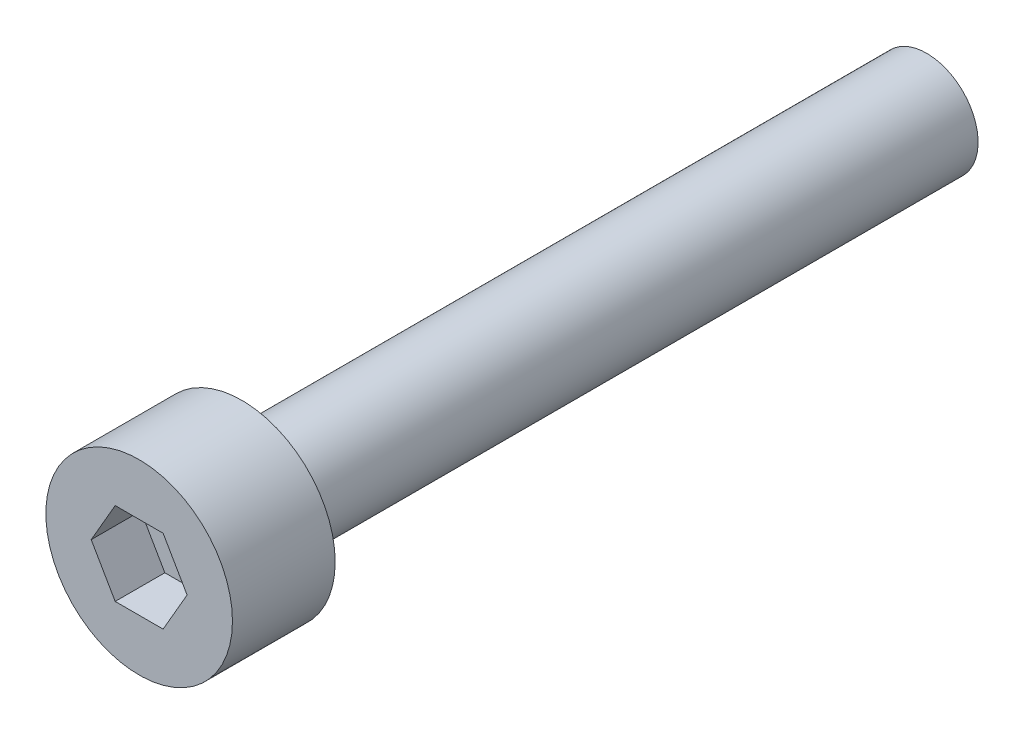
from build123d import *

# Parameters (mm, degrees)
SKETCH1_W           = 2.725
SKETCH1_H           = 3
SKETCH2_R           = 1.5
BOSS_EXTRUDE1_DEPTH = 3
SKETCH3_R           = 1.5
BOSS_EXTRUDE2_DEPTH = 17
CUT_EXTRUDE1_DEPTH  = 1.45


with BuildPart() as part:
    # Sketch1 → Revolve1 (revolve)
    with BuildSketch(Plane(origin=(0, 0, 0), x_dir=(1, 0, 0), z_dir=(0, 1, 0))):
        with Locations((1.3625, 1.5)):
            Rectangle(SKETCH1_W, SKETCH1_H)
    revolve(axis=Axis((0, 0, -3), (0, 0, 1)))

    # Sketch2 → Boss-Extrude1 (add)
    with BuildSketch(Plane(origin=(0, 0, -3), x_dir=(-1, 0, 0), z_dir=(0, 0, -1))):
        Circle(SKETCH2_R)
    extrude(amount=BOSS_EXTRUDE1_DEPTH)

    # Sketch3 → Boss-Extrude2 (add)
    with BuildSketch(Plane(origin=(0, 0, -6), x_dir=(-1, 0, 0), z_dir=(0, 0, -1))):
        Circle(SKETCH3_R)
    extrude(amount=BOSS_EXTRUDE2_DEPTH)

    # Sketch4 → Cut-Extrude1 (cut)
    with BuildSketch(Plane.XY):
        Polygon((-1.4, 0), (-0.7, -1.212435565), (0.7, -1.212435565), (1.4, 0), (0.7, 1.212435565), (-0.7, 1.212435565), align=None)
    extrude(amount=-CUT_EXTRUDE1_DEPTH, mode=Mode.SUBTRACT)


solid = part.part
